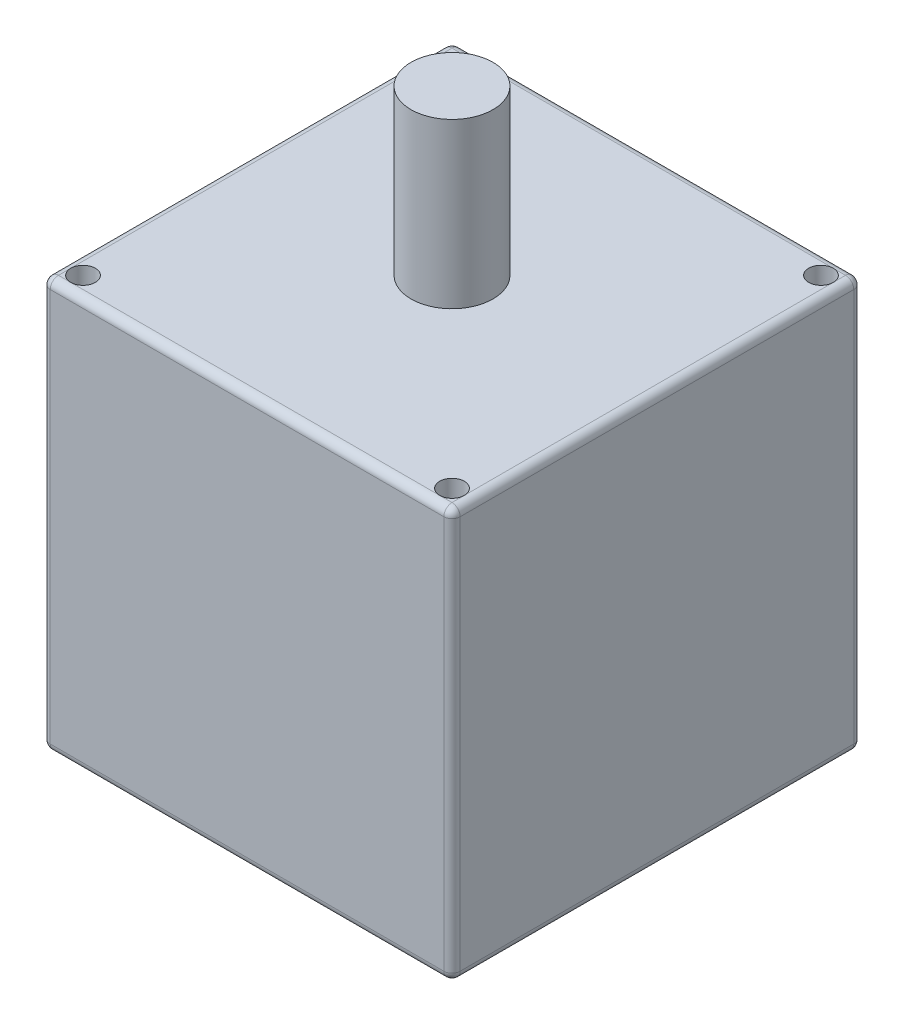
from build123d import *

# Parameters (mm, degrees)
SKETCH1_W                 = 50
SKETCH1_H                 = 50
BOSS_EXTRUDE1_DEPTH       = 50
FILLET1_R                 = 1
F_3_0MM_DOWEL_HOLE1_D     = 3
F_3_0MM_DOWEL_HOLE1_DEPTH = 10
F_3_0MM_DOWEL_HOLE1_TIP   = 0.901290929
SKETCH5_R                 = 5
BOSS_EXTRUDE2_DEPTH       = 20


with BuildPart() as part:
    # Sketch1 → Boss-Extrude1 (new body)
    with BuildSketch(Plane(origin=(0, 0, 0), x_dir=(1, 0, 0), z_dir=(0, 1, 0))):
        Rectangle(SKETCH1_W, SKETCH1_H)
    extrude(amount=BOSS_EXTRUDE1_DEPTH)

    # Fillet1
    fillet1_edges = [part.edges().sort_by_distance(p)[0] for p in [
        (-25, 50, 0),
        (0, 50, 25),
        (25, 50, 0),
        (0, 0, 25),
        (-25, 0, 0),
        (0, 0, -25),
        (25, 0, 0),
        (0, 50, -25),
        (25, 25, 25),
        (-25, 25, 25),
        (-25, 25, -25),
        (25, 25, -25),
    ]]
    fillet(fillet1_edges, radius=FILLET1_R)

    # Ø3.0mm Dowel Hole1
    with Locations(Plane(origin=(0, 50, 0), x_dir=(1, 0, 0), z_dir=(0, 1, 0))):
        with Locations((-22.5, 22.5), (22.5, 22.5), (22.5, -22.5), (-22.5, -22.5)):
            Hole(F_3_0MM_DOWEL_HOLE1_D / 2, depth=F_3_0MM_DOWEL_HOLE1_DEPTH)
            with Locations((0, 0, -(F_3_0MM_DOWEL_HOLE1_DEPTH + F_3_0MM_DOWEL_HOLE1_TIP / 2))):  # 118° drill point
                Cone(0, F_3_0MM_DOWEL_HOLE1_D / 2, F_3_0MM_DOWEL_HOLE1_TIP, mode=Mode.SUBTRACT)

    # Sketch5 → Boss-Extrude2 (add)
    with BuildSketch(Plane(origin=(0, 50, 0), x_dir=(1, 0, 0), z_dir=(0, 1, 0))):
        with Locations(Location((0, 0, 0), (0, 0, 270))):
            Circle(SKETCH5_R)
    extrude(amount=BOSS_EXTRUDE2_DEPTH)


solid = part.part
